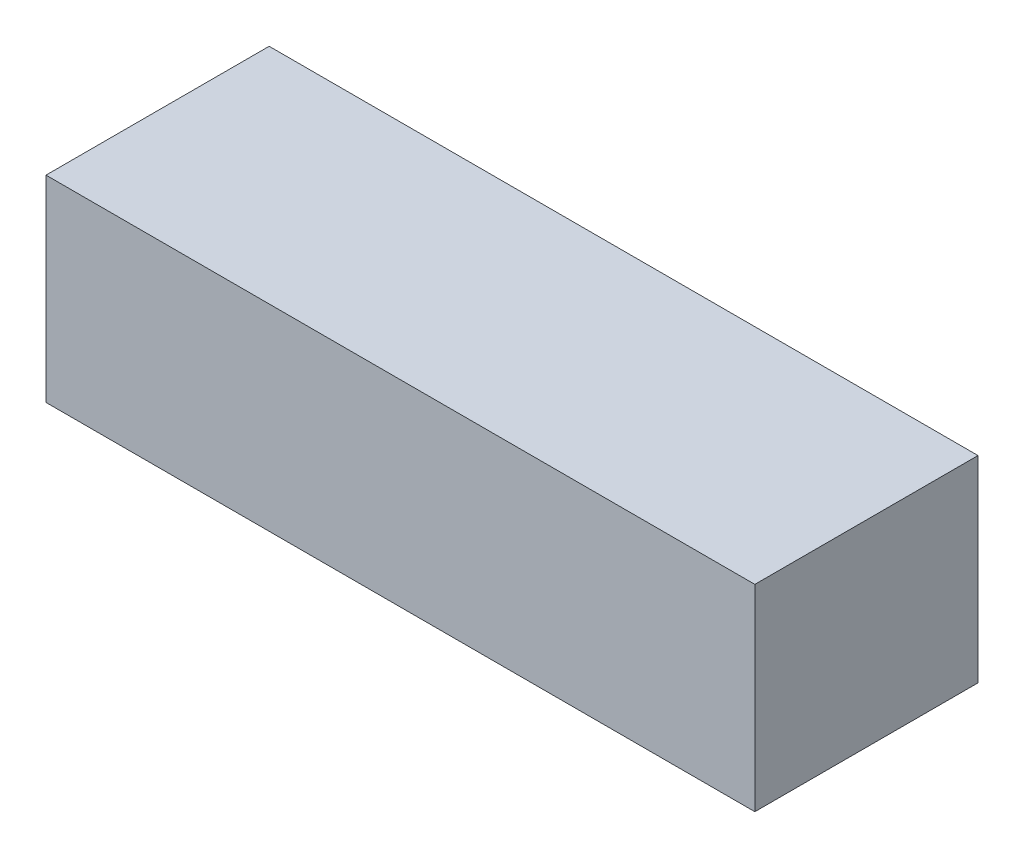
from build123d import *

# Parameters (mm, degrees)
SKETCH1_W           = 108
SKETCH1_H           = 34
BOSS_EXTRUDE1_DEPTH = 30


with BuildPart() as part:
    # Sketch1 → Boss-Extrude1 (new body)
    with BuildSketch(Plane(origin=(0, 0, 0), x_dir=(1, 0, 0), z_dir=(0, 1, 0))):
        Rectangle(SKETCH1_W, SKETCH1_H)
    extrude(amount=BOSS_EXTRUDE1_DEPTH)


solid = part.part
